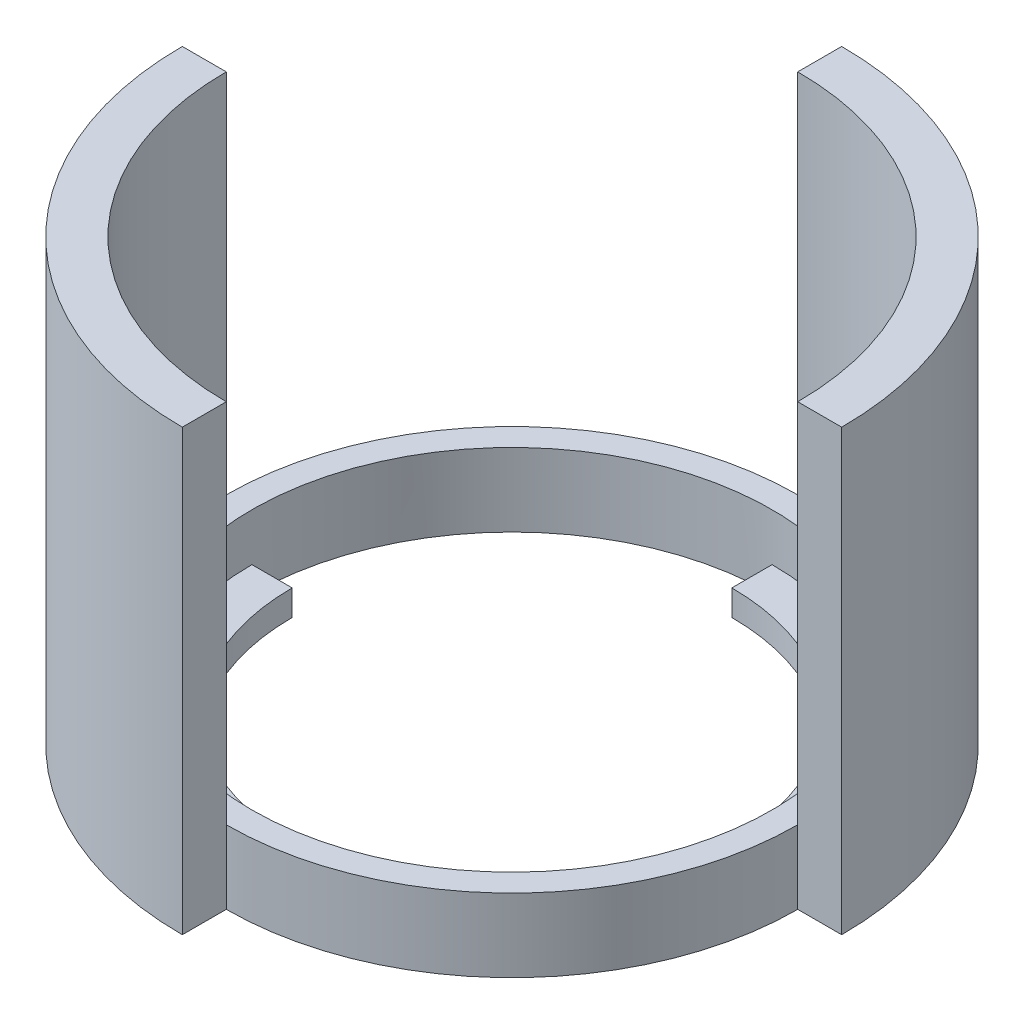
from build123d import *

# Parameters (mm, degrees)
ESBO_O1_R            = 39
EXTRUS_O1_DEPTH      = 5
EXTRUS_O2_DEPTH      = 50
EXTRUS_O2_DEPTH_BACK = 5
EXTRUS_O11_START     = 5
EXTRUS_O11_DEPTH     = 5
ESBO_O7_R            = 35.5
EXTRUS_O12_DEPTH     = 10
EXTRUS_O13_START     = -3.5
EXTRUS_O13_DEPTH     = 3.5


with BuildPart() as part:
    # Esboço1 → Extrusão1 (new body)
    with BuildSketch(Plane(origin=(0, 0, 0), x_dir=(1, 0, 0), z_dir=(0, 1, 0))):
        with Locations(Location((0, 0, 0), (0, 0, 270))):
            Circle(ESBO_O1_R)
    extrude(amount=EXTRUS_O1_DEPTH)

    # Esboço3 → Extrusão2 (add, two sides: drawn at the far end of the back side and taken through both)
    with BuildSketch(Plane(origin=(0, 5, 0), x_dir=(-1, 0, 0), z_dir=(0, 1, 0)).offset(-EXTRUS_O2_DEPTH_BACK)):
        with BuildLine():
            Line((39, 0), (45, 0))
            ThreePointArc((45, 0), (31.819805153, 31.819805153), (0, 45))
            Line((0, 45), (0, 39))
            ThreePointArc((0, 39), (27.577164466, 27.577164466), (39, 0))
        make_face()
        with BuildLine():
            Line((0, -45), (0, -39))
            ThreePointArc((0, -39), (-27.577164466, -27.577164466), (-39, 0))
            Line((-39, 0), (-45, 0))
            ThreePointArc((-45, 0), (-31.819805153, -31.819805153), (0, -45))
        make_face()
    extrude(amount=EXTRUS_O2_DEPTH + EXTRUS_O2_DEPTH_BACK)

    # Esboço5 → Extrusão11 (add)
    with BuildSketch(Plane.XZ.offset(EXTRUS_O11_START)):
        with BuildLine():
            Line((0, 45), (0, 39))
            ThreePointArc((0, 39), (27.577164466, 27.577164466), (39, 0))
            Line((39, 0), (45, 0))
            ThreePointArc((45, 0), (31.819805153, -31.819805153), (0, -45))
            Line((0, -45), (0, -39))
            ThreePointArc((0, -39), (-27.577164466, -27.577164466), (-39, 0))
            Line((-39, 0), (-45, 0))
            ThreePointArc((-45, 0), (-31.819805153, 31.819805153), (0, 45))
        make_face()
    extrude(amount=-EXTRUS_O11_DEPTH)

    # Esboço7 → Extrusão12 (cut)
    with BuildSketch(Plane(origin=(0, 5, 0), x_dir=(1, 0, 0), z_dir=(0, 1, 0))):
        with Locations(Location((0, 0, 0), (0, 0, 270))):
            Circle(ESBO_O7_R)
    extrude(amount=-EXTRUS_O12_DEPTH, mode=Mode.SUBTRACT)

    # Esboço8 → Extrusão13 (add)
    with BuildSketch(Plane.XZ.offset(5).offset(EXTRUS_O13_START)):
        with BuildLine():
            ThreePointArc((0, 35.5), (-9.188076101, 34.290366833), (-17.75, 30.743901834))
            Line((-17.75, 30.743901834), (-15, 25.980762114))
            ThreePointArc((-15, 25.980762114), (-7.764571353, 28.977774789), (0, 30))
            Line((0, 30), (0, 35.5))
        make_face()
        with BuildLine():
            ThreePointArc((-30.743901834, 17.75), (-34.290366833, 9.188076101), (-35.5, 0))
            Line((-35.5, 0), (-30, 0))
            ThreePointArc((-30, 0), (-28.977774789, 7.764571353), (-25.980762114, 15))
            Line((-25.980762114, 15), (-30.743901834, 17.75))
        make_face()
        with BuildLine():
            Line((0, -30), (0, -35.5))
            ThreePointArc((0, -35.5), (9.188076101, -34.290366833), (17.75, -30.743901834))
            Line((17.75, -30.743901834), (15, -25.980762114))
            ThreePointArc((15, -25.980762114), (7.764571353, -28.977774789), (0, -30))
        make_face()
        with BuildLine():
            Line((25.980762114, -15), (30.743901834, -17.75))
            ThreePointArc((30.743901834, -17.75), (34.290366833, -9.188076101), (35.5, 0))
            Line((35.5, 0), (30, 0))
            ThreePointArc((30, 0), (28.977774789, -7.764571353), (25.980762114, -15))
        make_face()
    extrude(amount=EXTRUS_O13_DEPTH)


solid = part.part
